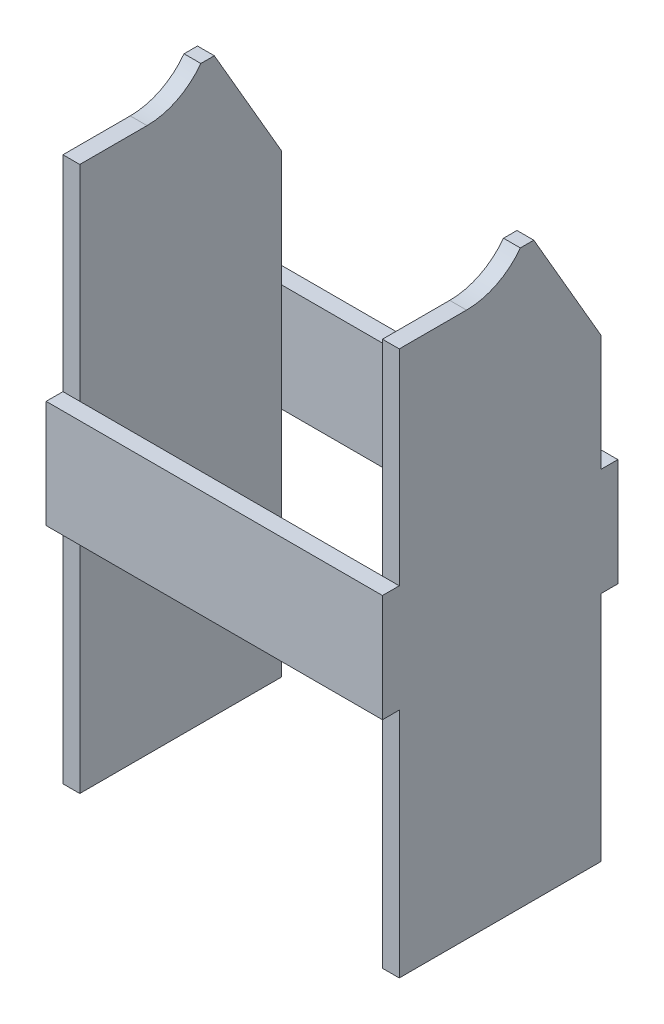
from build123d import *

# Parameters (mm, degrees)
SKETCH_1_W          = 5
SKETCH_1_H          = 60
EXTRUDE_1_DEPTH     = 170
EXTRUDE_1_2_DEPTH   = 170
SKETCH_2_W          = 5
SKETCH_2_H          = 32
EXTRUDE_2_DEPTH     = 100
CUT_EXTRUDE_2_DEPTH = 120


with BuildPart() as part:
    # 草图1 → 凸台-拉伸1 (new body)
    with BuildSketch(Plane(origin=(0, 0, 0), x_dir=(1, 0, 0), z_dir=(0, 1, 0))):
        with Locations((-47.5, 0)):
            Rectangle(SKETCH_1_W, SKETCH_1_H)
    extrude(amount=EXTRUDE_1_DEPTH)



with BuildPart() as body_2:
    # 草图1 → Extrude 1 2 (new body)
    with BuildSketch(Plane(origin=(0, 0, 0), x_dir=(1, 0, 0), z_dir=(0, 1, 0))):
        with Locations((47.5, 0)):
            Rectangle(SKETCH_1_W, SKETCH_1_H)
    extrude(amount=EXTRUDE_1_2_DEPTH)


with BuildPart() as part_1:
    add(part.part)

    add(body_2.part)  # 凸台-拉伸2 merges body 2
    # 草图2 → 凸台-拉伸2 (add)
    with BuildSketch(Plane(origin=(50, 0, 0), x_dir=(0, 0, -1), z_dir=(1, 0, 0))):
        with Locations((-32.5, 85)):
            Rectangle(SKETCH_2_W, SKETCH_2_H)
        with Locations((32.5, 85)):
            Rectangle(SKETCH_2_W, SKETCH_2_H)
    extrude(amount=-EXTRUDE_2_DEPTH)

    # 草图3 → 切除-拉伸2 (cut)
    with BuildSketch(Plane.ZY.offset(50)):
        Polygon((-10, 170), (-30, 135.5), (-48.568866089, 135.5), (-48.568866089, 174.591079236), (-10, 174.591079236), align=None)
        with BuildLine():
            Line((10, 162), (30, 162))
            Line((30, 162), (30, 182))
            ThreePointArc((30, 182), (-4.142135624, 196.142135624), (10, 162))
        make_face()
    extrude(amount=-CUT_EXTRUDE_2_DEPTH, mode=Mode.SUBTRACT)


solid = part_1.part
